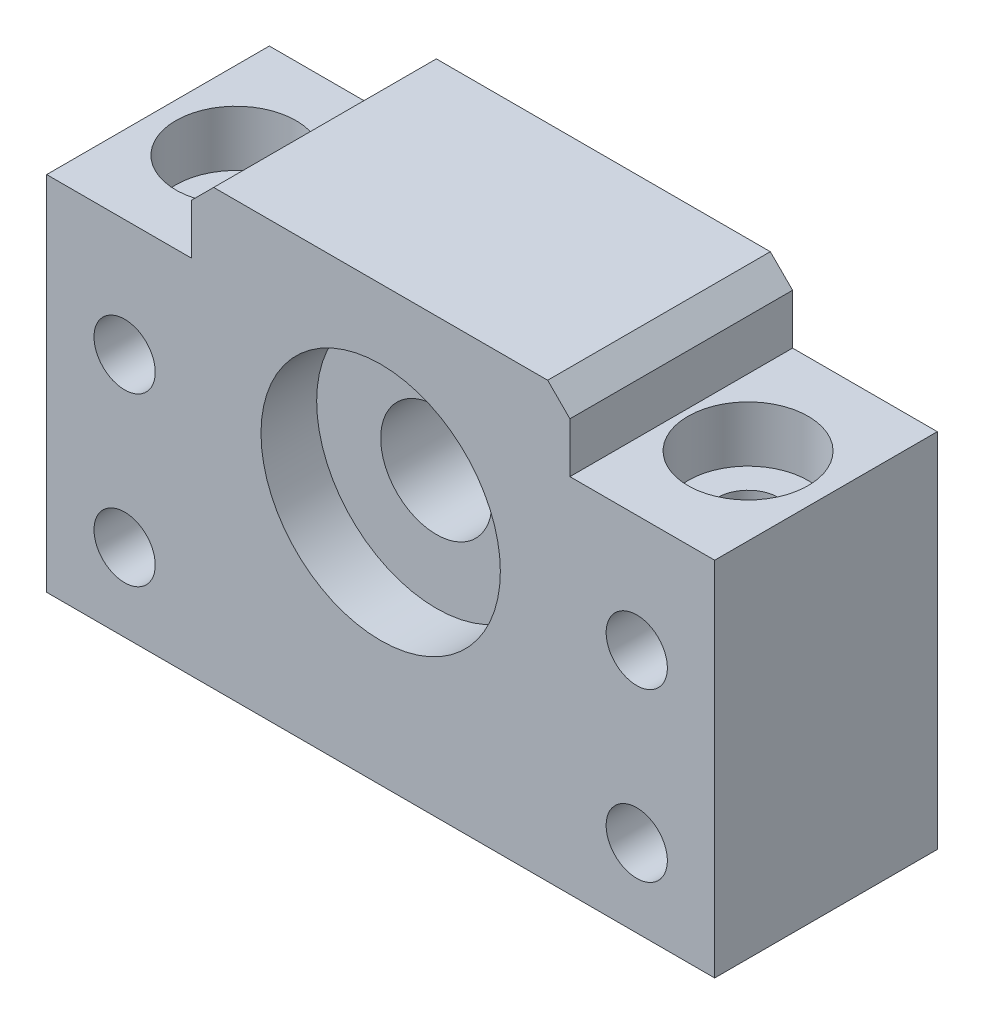
from build123d import *

# Parameters (mm, degrees)
SKETCH2_R           = 10.75
SKETCH2_R_2         = 2.75
BOSS_EXTRUDE2_DEPTH = 10
SKETCH3_R           = 2.75
CUT_EXTRUDE1_DEPTH  = 51.209560843
SKETCH4_R           = 5.4
CUT_EXTRUDE2_DEPTH  = 5
SKETCH5_R           = 10.75
SKETCH5_R_2         = 5
BOSS_EXTRUDE4_DEPTH = 5


with BuildPart() as part:
    # Sketch2 → Boss-Extrude2 (new, symmetric)
    with BuildSketch(Plane.XY):
        Polygon((15, 17), (-15, 17), (-17, 15), (-17, 10.5), (-30, 10.5), (-30, -22), (30, -22), (30, 10.5), (17, 10.5), (17, 15), align=None)
        Circle(SKETCH2_R, mode=Mode.SUBTRACT)
        with Locations((-23, 0)):
            Circle(SKETCH2_R_2, mode=Mode.SUBTRACT)
        with Locations((-23, -15)):
            Circle(SKETCH2_R_2, mode=Mode.SUBTRACT)
        with Locations(Location((23, -15, 0), (0, 0, 180))):
            Circle(SKETCH2_R_2, mode=Mode.SUBTRACT)
        with Locations(Location((23, 0, 0), (0, 0, 180))):
            Circle(SKETCH2_R_2, mode=Mode.SUBTRACT)
    extrude(amount=BOSS_EXTRUDE2_DEPTH, both=True)

    # Sketch3 → Cut-Extrude1 (cut, through all)
    with BuildSketch(Plane.XZ.offset(22)):
        with Locations((23, 0)):
            Circle(SKETCH3_R)
        with Locations((-23, 0)):
            Circle(SKETCH3_R)
    extrude(amount=-CUT_EXTRUDE1_DEPTH, mode=Mode.SUBTRACT)

    # Sketch4 → Cut-Extrude2 (cut)
    with BuildSketch(Plane(origin=(0, 10.5, 0), x_dir=(1, 0, 0), z_dir=(0, 1, 0))):
        with Locations(Location((-23, 0, 0), (0, 0, 180))):
            Circle(SKETCH4_R)
        with Locations(Location((23, 0, 0), (0, 0, 180))):
            Circle(SKETCH4_R)
    extrude(amount=-CUT_EXTRUDE2_DEPTH, mode=Mode.SUBTRACT)


with BuildPart() as body_2:
    # Sketch5 → Boss-Extrude4 (new, symmetric)
    with BuildSketch(Plane.XY):
        Circle(SKETCH5_R)
        Circle(SKETCH5_R_2, mode=Mode.SUBTRACT)
    extrude(amount=BOSS_EXTRUDE4_DEPTH, both=True)


solid = Compound([part.part, body_2.part])
